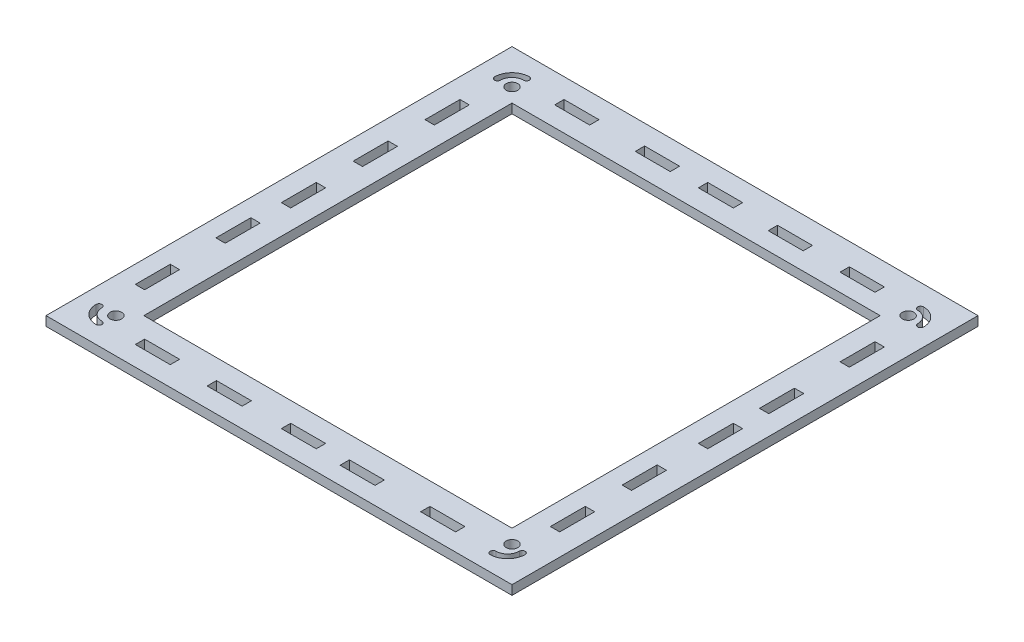
from build123d import *

# Parameters (mm, degrees)
CROQUIS1_W              = 200
CROQUIS1_H              = 200
CROQUIS1_R              = 2.5
SALIENTE_EXTRUIR1_DEPTH = 4
CROQUIS2_W              = 158
CROQUIS2_H              = 158
CORTAR_EXTRUIR1_DEPTH   = 10
CROQUIS4_W              = 4
CROQUIS4_H              = 15
CROQUIS4_W_2            = 15
CROQUIS4_H_2            = 4
CORTAR_EXTRUIR2_DEPTH   = 10


with BuildPart() as part:
    # Croquis1 → Saliente-Extruir1 (new body)
    with BuildSketch(Plane(origin=(0, 0, 0), x_dir=(1, 0, 0), z_dir=(0, 1, 0))):
        with Locations((100, 100)):
            Rectangle(CROQUIS1_W, CROQUIS1_H)
        with Locations(Location((15, 185, 0), (0, 0, 270))):
            Circle(CROQUIS1_R, mode=Mode.SUBTRACT)
        with Locations(Location((185, 185, 0), (0, 0, 270))):
            Circle(CROQUIS1_R, mode=Mode.SUBTRACT)
        with Locations(Location((185, 15, 0), (0, 0, 270))):
            Circle(CROQUIS1_R, mode=Mode.SUBTRACT)
        with Locations(Location((15, 15, 0), (0, 0, 270))):
            Circle(CROQUIS1_R, mode=Mode.SUBTRACT)
    extrude(amount=SALIENTE_EXTRUIR1_DEPTH)

    # Croquis2 → Cortar-Extruir1 (cut)
    with BuildSketch(Plane(origin=(0, 4, 0), x_dir=(1, 0, 0), z_dir=(0, 1, 0))):
        with Locations((100, 100)):
            Rectangle(CROQUIS2_W, CROQUIS2_H)
    extrude(amount=-CORTAR_EXTRUIR1_DEPTH, mode=Mode.SUBTRACT)

    # Croquis4 → Cortar-Extruir2 (cut)
    with BuildSketch(Plane(origin=(0, 4, 0), x_dir=(1, 0, 0), z_dir=(0, 1, 0))):
        with Locations((10.5, 130.833333333)):
            Rectangle(CROQUIS4_W, CROQUIS4_H)
        with Locations((10.5, 161.666666667)):
            Rectangle(CROQUIS4_W, CROQUIS4_H)
        with Locations((38.333333333, 189.5)):
            Rectangle(CROQUIS4_W_2, CROQUIS4_H_2)
        with Locations((72.916666667, 189.5)):
            Rectangle(CROQUIS4_W_2, CROQUIS4_H_2)
        with Locations((189.564602861, 126.146591855)):
            Rectangle(CROQUIS4_W, CROQUIS4_H)
        with Locations((189.564602861, 160.729925188)):
            Rectangle(CROQUIS4_W, CROQUIS4_H)
        with Locations((130.897936194, 188.563258522)):
            Rectangle(CROQUIS4_W_2, CROQUIS4_H_2)
        with Locations((161.731269527, 188.563258522)):
            Rectangle(CROQUIS4_W_2, CROQUIS4_H_2)
        with Locations((126.211194716, 9.498655661)):
            Rectangle(CROQUIS4_W_2, CROQUIS4_H_2)
        with Locations((160.794528049, 9.498655661)):
            Rectangle(CROQUIS4_W_2, CROQUIS4_H_2)
        with Locations((188.627861382, 68.165322328)):
            Rectangle(CROQUIS4_W, CROQUIS4_H)
        with Locations((188.627861382, 37.331988994)):
            Rectangle(CROQUIS4_W, CROQUIS4_H)
        with Locations((9.563258522, 72.852063806)):
            Rectangle(CROQUIS4_W, CROQUIS4_H)
        with Locations((9.563258522, 38.268730473)):
            Rectangle(CROQUIS4_W, CROQUIS4_H)
        with Locations((68.229925188, 10.435397139)):
            Rectangle(CROQUIS4_W_2, CROQUIS4_H_2)
        with Locations((37.396591855, 10.435397139)):
            Rectangle(CROQUIS4_W_2, CROQUIS4_H_2)
        with Locations((100, 189.5)):
            Rectangle(CROQUIS4_W_2, CROQUIS4_H_2)
        with Locations((10.5, 100)):
            Rectangle(CROQUIS4_W, CROQUIS4_H)
        with Locations((189.5, 100)):
            Rectangle(CROQUIS4_W, CROQUIS4_H)
        with Locations((100, 10.5)):
            Rectangle(CROQUIS4_W_2, CROQUIS4_H_2)
        with BuildLine():
            ThreePointArc((15, 192.5), (9.696699141, 190.303300859), (7.5, 185))
            ThreePointArc((7.5, 185), (8.75, 183.75), (10, 185))
            ThreePointArc((10, 185), (11.464466094, 188.535533906), (15, 190))
            ThreePointArc((15, 190), (16.25, 191.25), (15, 192.5))
        make_face()
        with BuildLine():
            ThreePointArc((185.064602861, 191.563258522), (183.814602861, 190.313258522), (185.064602861, 189.063258522))
            ThreePointArc((185.064602861, 189.063258522), (188.600136767, 187.598792428), (190.064602861, 184.063258522))
            ThreePointArc((190.064602861, 184.063258522), (191.314602861, 182.813258522), (192.564602861, 184.063258522))
            ThreePointArc((192.564602861, 184.063258522), (190.367903719, 189.366559381), (185.064602861, 191.563258522))
        make_face()
        with BuildLine():
            ThreePointArc((191.627861382, 13.998655661), (190.377861382, 15.248655661), (189.127861382, 13.998655661))
            ThreePointArc((189.127861382, 13.998655661), (187.663395288, 10.463121755), (184.127861382, 8.998655661))
            ThreePointArc((184.127861382, 8.998655661), (182.877861382, 7.748655661), (184.127861382, 6.498655661))
            ThreePointArc((184.127861382, 6.498655661), (189.431162241, 8.695354802), (191.627861382, 13.998655661))
        make_face()
        with BuildLine():
            ThreePointArc((14.063258522, 7.435397139), (15.313258522, 8.685397139), (14.063258522, 9.935397139))
            ThreePointArc((14.063258522, 9.935397139), (10.527724616, 11.399863233), (9.063258522, 14.935397139))
            ThreePointArc((9.063258522, 14.935397139), (7.813258522, 16.185397139), (6.563258522, 14.935397139))
            ThreePointArc((6.563258522, 14.935397139), (8.759957663, 9.632096281), (14.063258522, 7.435397139))
        make_face()
    extrude(amount=-CORTAR_EXTRUIR2_DEPTH, mode=Mode.SUBTRACT)


solid = part.part
